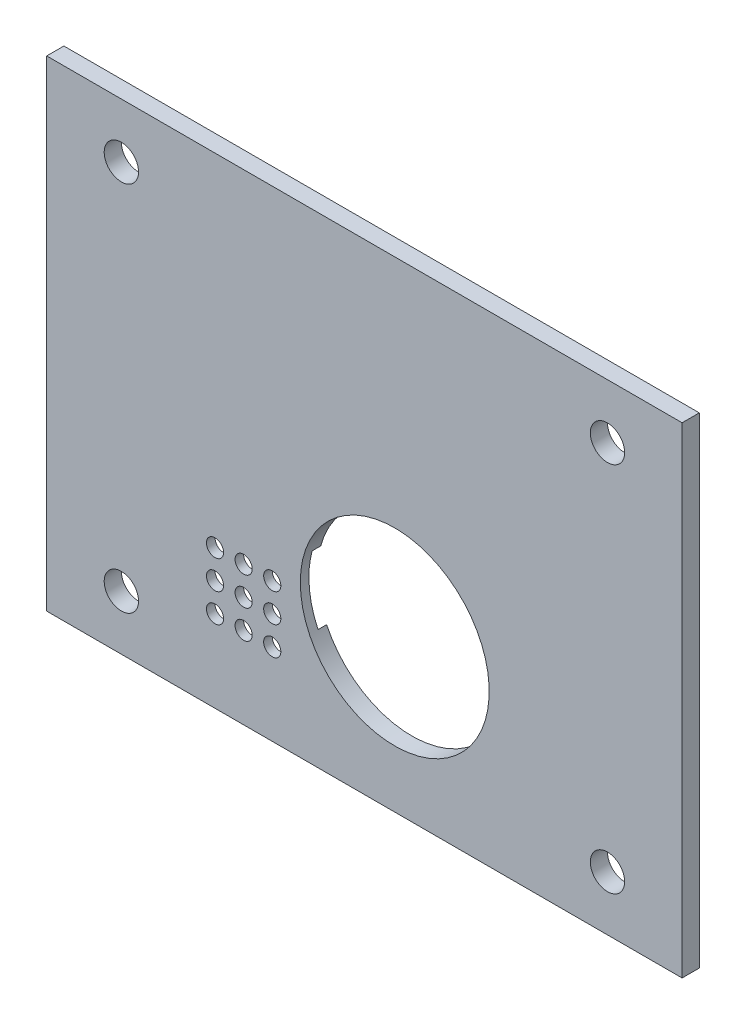
from build123d import *

# Parameters (mm, degrees)
SKETCH_1_W                                = 111
SKETCH_1_H                                = 84
BOTTOM_LOWER_BASE_PLATE_3MM_DEPTH         = 3
SKETCH_3_R                                = 3
BOTTOM_LOWER_SCREW_6MM_THROUGH_DEPTH      = 3
SKETCH_5_R                                = 16.5
BOTTOM_LOWER_BATTERY_CLEARANCE_33MM_DEPTH = 3
SKETCH_7_W                                = 23
SKETCH_7_H                                = 23
BOTTOM_LOWER_BUZZER_POCKET_1P5MM_DEPTH    = 1.5
BOTTOM_LOWER_BUZZER_SOUND_HOLES_3MM_START = 1.5
SKETCH_9_R                                = 1.5
BOTTOM_LOWER_BUZZER_SOUND_HOLES_3MM_DEPTH = 1.5


with BuildPart() as part:
    # Эскиз1 → bottom_lower_base_plate_3mm (new body)
    with BuildSketch(Plane.XY):
        with Locations((53.5, 40)):
            Rectangle(SKETCH_1_W, SKETCH_1_H)
    extrude(amount=BOTTOM_LOWER_BASE_PLATE_3MM_DEPTH)

    # Эскиз3 → bottom_lower_screw_6mm_through (cut)
    with BuildSketch(Plane.XY):
        with Locations(Location((11.04, 7.54, 0), (0, 0, 180))):
            Circle(SKETCH_3_R)
        with Locations(Location((95.96, 7.54, 0), (0, 0, 180))):
            Circle(SKETCH_3_R)
        with Locations(Location((11.04, 72.46, 0), (0, 0, 180))):
            Circle(SKETCH_3_R)
        with Locations(Location((95.96, 72.46, 0), (0, 0, 180))):
            Circle(SKETCH_3_R)
    extrude(amount=BOTTOM_LOWER_SCREW_6MM_THROUGH_DEPTH, mode=Mode.SUBTRACT)

    # Эскиз5 → bottom_lower_battery_clearance_33mm (cut)
    with BuildSketch(Plane.XY):
        with Locations(Location((58.8, 24.5, 0), (0, 0, 180))):
            Circle(SKETCH_5_R)
    extrude(amount=BOTTOM_LOWER_BATTERY_CLEARANCE_33MM_DEPTH, mode=Mode.SUBTRACT)

    # Эскиз7 → bottom_lower_buzzer_pocket_1p5mm (cut)
    with BuildSketch(Plane.XY):
        with Locations((32.4, 17.3)):
            Rectangle(SKETCH_7_W, SKETCH_7_H)
    extrude(amount=BOTTOM_LOWER_BUZZER_POCKET_1P5MM_DEPTH, mode=Mode.SUBTRACT)

    # Эскиз9 → bottom_lower_buzzer_sound_holes_3mm (cut)
    with BuildSketch(Plane.XY.offset(BOTTOM_LOWER_BUZZER_SOUND_HOLES_3MM_START)):
        with Locations(Location((27.4, 12.3, 0), (0, 0, 180))):
            Circle(SKETCH_9_R)
        with Locations(Location((27.4, 17.3, 0), (0, 0, 180))):
            Circle(SKETCH_9_R)
        with Locations(Location((27.4, 22.3, 0), (0, 0, 180))):
            Circle(SKETCH_9_R)
        with Locations(Location((32.4, 12.3, 0), (0, 0, 180))):
            Circle(SKETCH_9_R)
        with Locations(Location((32.4, 17.3, 0), (0, 0, 180))):
            Circle(SKETCH_9_R)
        with Locations(Location((32.4, 22.3, 0), (0, 0, 180))):
            Circle(SKETCH_9_R)
        with Locations(Location((37.4, 12.3, 0), (0, 0, 180))):
            Circle(SKETCH_9_R)
        with Locations(Location((37.4, 17.3, 0), (0, 0, 180))):
            Circle(SKETCH_9_R)
        with Locations(Location((37.4, 22.3, 0), (0, 0, 180))):
            Circle(SKETCH_9_R)
    extrude(amount=BOTTOM_LOWER_BUZZER_SOUND_HOLES_3MM_DEPTH, mode=Mode.SUBTRACT)


solid = part.part
